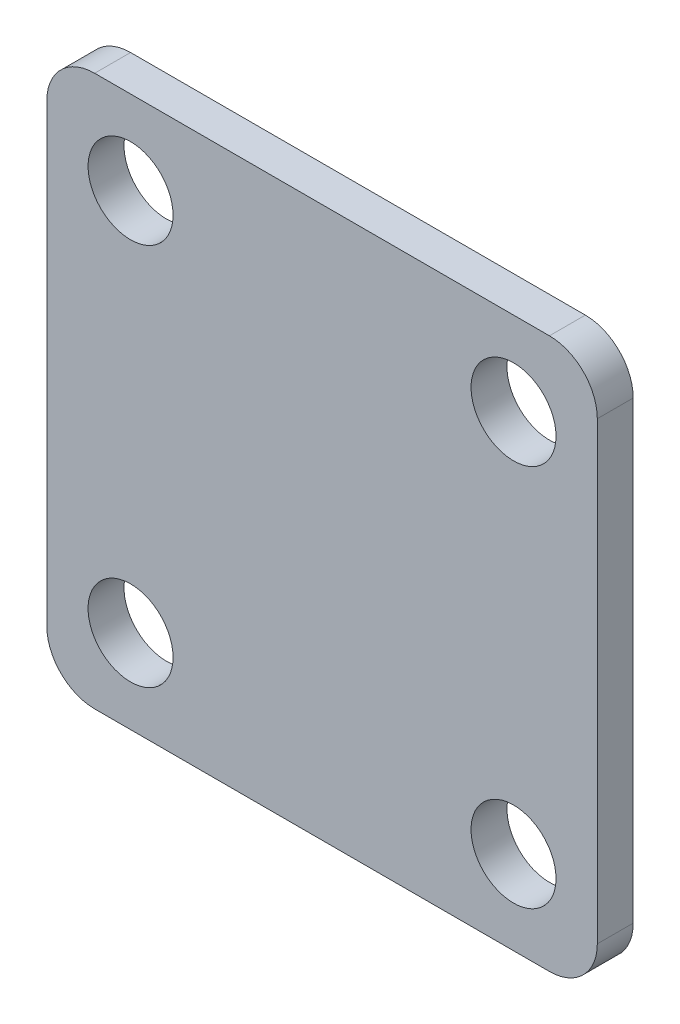
from build123d import *

# Parameters (mm, degrees)
SKETCH1_R           = 1.775
BOSS_EXTRUDE1_DEPTH = 1.5


with BuildPart() as part:
    # Sketch1 → Boss-Extrude1 (new body)
    with BuildSketch(Plane.XY):
        with BuildLine():
            Line((-9.5, 11.5), (9.5, 11.5))
            ThreePointArc((9.5, 11.5), (10.914213562, 10.914213562), (11.5, 9.5))
            Line((11.5, 9.5), (11.5, -9.5))
            ThreePointArc((11.5, -9.5), (10.914213562, -10.914213562), (9.5, -11.5))
            Line((9.5, -11.5), (-9.5, -11.5))
            ThreePointArc((-9.5, -11.5), (-10.914213562, -10.914213562), (-11.5, -9.5))
            Line((-11.5, -9.5), (-11.5, 9.5))
            ThreePointArc((-11.5, 9.5), (-10.914213562, 10.914213562), (-9.5, 11.5))
        make_face()
        with Locations((-8.0000004, 8.0000004)):
            Circle(SKETCH1_R, mode=Mode.SUBTRACT)
        with Locations((7.9999996, 7.9999996)):
            Circle(SKETCH1_R, mode=Mode.SUBTRACT)
        with Locations((8.0000004, -8.0000004)):
            Circle(SKETCH1_R, mode=Mode.SUBTRACT)
        with Locations((-7.9999996, -7.9999996)):
            Circle(SKETCH1_R, mode=Mode.SUBTRACT)
    extrude(amount=BOSS_EXTRUDE1_DEPTH)


solid = part.part
